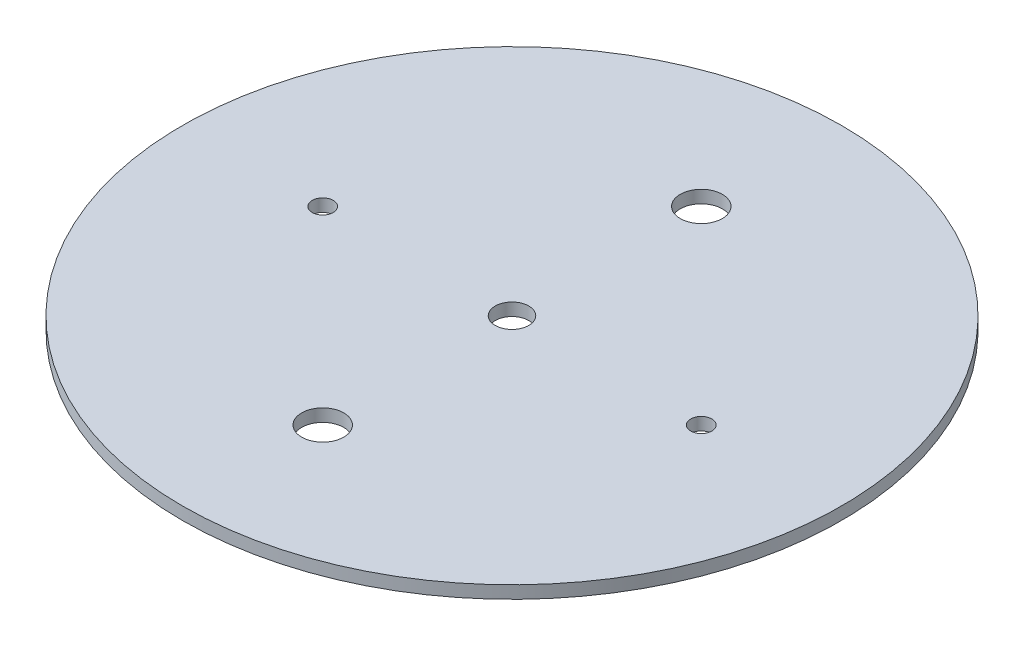
from build123d import *

# Parameters (mm, degrees)
SKETCH1_R           = 78.35
SKETCH1_R_2         = 2.5
SKETCH1_R_3         = 4
SKETCH1_R_4         = 5
BOSS_EXTRUDE1_DEPTH = 3


with BuildPart() as part:
    # Sketch1 → Boss-Extrude1 (new body)
    with BuildSketch(Plane(origin=(0, 0, 0), x_dir=(1, 0, 0), z_dir=(0, 1, 0))):
        with Locations(Location((0, 0, 0), (0, 0, 270))):
            Circle(SKETCH1_R)
        with Locations(Location((-45, 0, 0), (0, 0, 270))):
            Circle(SKETCH1_R_2, mode=Mode.SUBTRACT)
        with Locations(Location((45, 0, 0), (0, 0, 270))):
            Circle(SKETCH1_R_2, mode=Mode.SUBTRACT)
        with Locations(Location((0, 0, 0), (0, 0, 270))):
            Circle(SKETCH1_R_3, mode=Mode.SUBTRACT)
        with Locations(Location((0, -45, 0), (0, 0, 270))):
            Circle(SKETCH1_R_4, mode=Mode.SUBTRACT)
        with Locations(Location((0, 45, 0), (0, 0, 270))):
            Circle(SKETCH1_R_4, mode=Mode.SUBTRACT)
    extrude(amount=BOSS_EXTRUDE1_DEPTH)


solid = part.part
